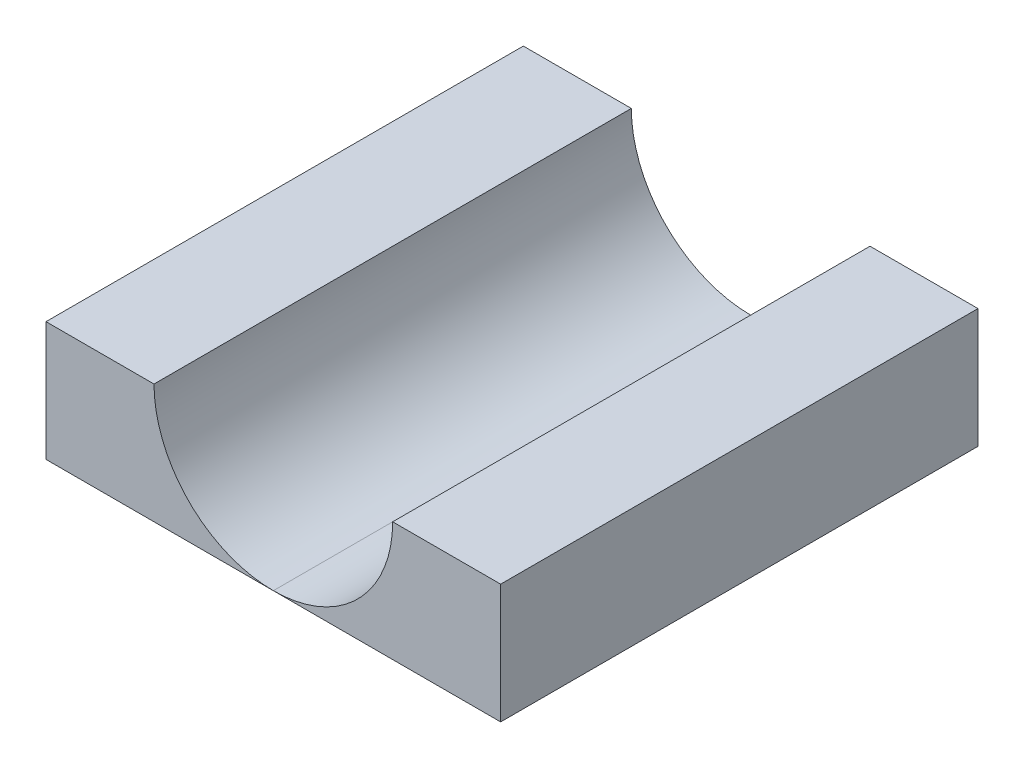
from build123d import *

# Parameters (mm, degrees)
BOSS_EXTRUDE1_DEPTH   = 20
BOSS_EXTRUDE1_2_DEPTH = 20


with BuildPart() as part:
    # Sketch1 → Boss-Extrude1 (new body)
    with BuildSketch(Plane.XY):
        with BuildLine():
            Line((0, 5), (0, 0))
            Line((0, 0), (9.525, 0))
            ThreePointArc((9.525, 0), (5.989466094, 1.464466094), (4.525, 5))
            Line((4.525, 5), (0, 5))
        make_face()
    extrude(amount=BOSS_EXTRUDE1_DEPTH)


with BuildPart() as body_2:
    # Sketch1 → Boss-Extrude1 2 (new body)
    with BuildSketch(Plane.XY):
        with BuildLine():
            ThreePointArc((14.525, 5), (13.060533906, 1.464466094), (9.525, 0))
            Line((9.525, 0), (19.05, 0))
            Line((19.05, 0), (19.05, 5))
            Line((19.05, 5), (14.525, 5))
        make_face()
    extrude(amount=BOSS_EXTRUDE1_2_DEPTH)


solid = Compound([part.part, body_2.part])
